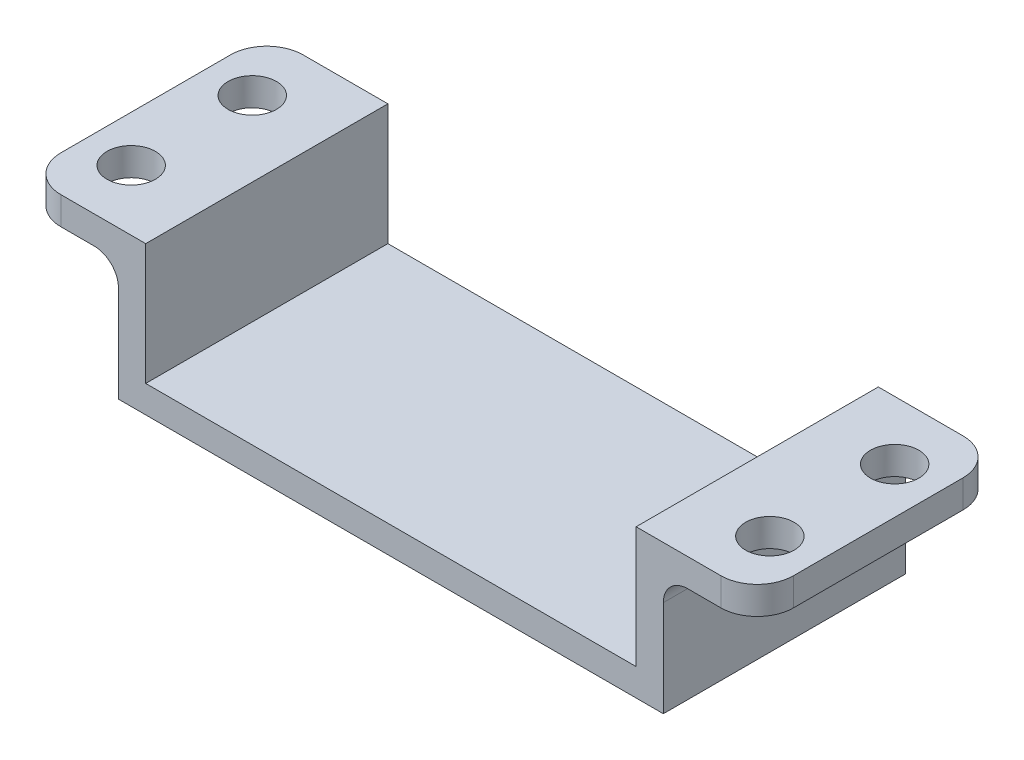
from build123d import *

# Parameters (mm, degrees)
SKETCH1_W           = 45
SKETCH1_H           = 20
BOSS_EXTRUDE1_DEPTH = 2.25
SKETCH2_W           = 2.25
SKETCH2_H           = 20
BOSS_EXTRUDE2_DEPTH = 10
SKETCH3_W           = 10
SKETCH3_H           = 20
BOSS_EXTRUDE3_DEPTH = 2.3
FILLET1_R           = 2
SKETCH4_R           = 2
CUT_EXTRUDE1_DEPTH  = 35.133927404
SKETCH5_R           = 2.5
BOSS_EXTRUDE4_DEPTH = 7
FILLET2_R           = 2
FILLET3_R           = 3


with BuildPart() as part:
    # Sketch1 → Boss-Extrude1 (new body)
    with BuildSketch(Plane(origin=(0, 0, 0), x_dir=(1, 0, 0), z_dir=(0, 1, 0))):
        Rectangle(SKETCH1_W, SKETCH1_H)
    extrude(amount=BOSS_EXTRUDE1_DEPTH)

    # Sketch2 → Boss-Extrude2 (add)
    with BuildSketch(Plane(origin=(0, 2.25, 0), x_dir=(1, 0, 0), z_dir=(0, 1, 0))):
        with Locations((-21.375, 0)):
            Rectangle(SKETCH2_W, SKETCH2_H)
        with Locations((21.375, 0)):
            Rectangle(SKETCH2_W, SKETCH2_H)
    extrude(amount=BOSS_EXTRUDE2_DEPTH)

    # Sketch3 → Boss-Extrude3 (add)
    with BuildSketch(Plane(origin=(0, 12.25, 0), x_dir=(1, 0, 0), z_dir=(0, 1, 0))):
        with Locations((-25.25, 0)):
            Rectangle(SKETCH3_W, SKETCH3_H)
        with Locations((25.25, 0)):
            Rectangle(SKETCH3_W, SKETCH3_H)
    extrude(amount=-BOSS_EXTRUDE3_DEPTH)

    # Fillet1
    fillet1_edges = [part.edges().sort_by_distance(p)[0] for p in [
        (-22.5, 9.95, 0),
        (22.5, 9.95, 0),
    ]]
    fillet(fillet1_edges, radius=FILLET1_R)

    # Sketch4 → Cut-Extrude1 (cut, through all)
    with BuildSketch(Plane(origin=(0, 12.25, 0), x_dir=(1, 0, 0), z_dir=(0, 1, 0))):
        with Locations(Location((26.45, 5.15278214, 0), (0, 0, 270))):
            Circle(SKETCH4_R)
        with Locations(Location((26.45, -5.15278214, 0), (0, 0, 270))):
            Circle(SKETCH4_R)
        with Locations(Location((-26.45, 5, 0), (0, 0, 270))):
            Circle(SKETCH4_R)
        with Locations(Location((-26.45, -5, 0), (0, 0, 270))):
            Circle(SKETCH4_R)
    extrude(amount=-CUT_EXTRUDE1_DEPTH, mode=Mode.SUBTRACT)

    # Sketch5 → Boss-Extrude4 (add)
    with BuildSketch(Plane.XZ):
        with Locations(Location((0, 0, 0), (0, 0, 270))):
            Circle(SKETCH5_R)
    extrude(amount=BOSS_EXTRUDE4_DEPTH)

    # Fillet2
    fillet2_edges = [part.edges().sort_by_distance(p)[0] for p in [
        (0, 0, 2.5),
    ]]
    fillet(fillet2_edges, radius=FILLET2_R)

    # Fillet3
    fillet3_edges = [part.edges().sort_by_distance(p)[0] for p in [
        (-30.25, 11.1, -10),
        (-30.25, 11.1, 10),
        (30.25, 11.1, 10),
        (30.25, 11.1, -10),
    ]]
    fillet(fillet3_edges, radius=FILLET3_R)


solid = part.part
